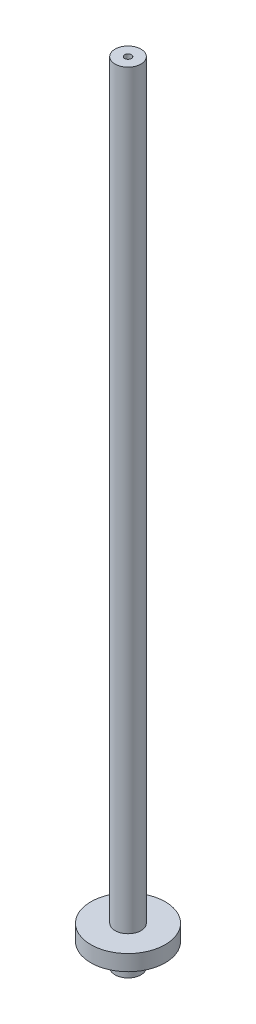
from build123d import *

# Parameters (mm, degrees)
SKETCH1_R           = 5.75
SKETCH1_R_2         = 2
BOSS_EXTRUDE1_DEPTH = 340
SKETCH33_R          = 16.5
BOSS_EXTRUDE2_DEPTH = 7
BOSS_EXTRUDE5_START = -10
SKETCH1_4_R         = 5.75
SKETCH1_4_R_2       = 2
BOSS_EXTRUDE5_DEPTH = 10
SKETCH38_R          = 2.125
CUT_EXTRUDE1_DEPTH  = 8
BOSS_EXTRUDE6_START = 8
BOSS_EXTRUDE6_DEPTH = 8
SKETCH40_R          = 1.5
CUT_EXTRUDE2_DEPTH  = 10


with BuildPart() as part:
    # Sketch1 → Boss-Extrude1 (new body)
    # profile 1 of 2: a face of its own
    with BuildSketch(Plane(origin=(0, 0, 0), x_dir=(1, 0, 0), z_dir=(0, 1, 0))):
        with Locations(Location((0, 0, 0), (0, 0, 270))):
            Circle(SKETCH1_R)
        Circle(SKETCH1_R_2, mode=Mode.SUBTRACT)
    # profile 2 of 2: a face of its own
    with BuildSketch(Plane(origin=(0, 0, 0), x_dir=(1, 0, 0), z_dir=(0, 1, 0))):
        Circle(SKETCH1_R_2)
    extrude(amount=BOSS_EXTRUDE1_DEPTH)

    # Sketch33 → Boss-Extrude2 (add)
    with BuildSketch(Plane.XZ):
        with Locations(Location((0, 0, 0), (0, 0, 270))):
            Circle(SKETCH33_R)
    extrude(amount=-BOSS_EXTRUDE2_DEPTH)

    # Sketch1<4> → Boss-Extrude5 (add)
    # profile 1 of 2: a face of its own
    with BuildSketch(Plane(origin=(0, 0, 0), x_dir=(1, 0, 0), z_dir=(0, 1, 0)).offset(BOSS_EXTRUDE5_START)):
        with Locations(Location((0, 0, 0), (0, 0, 90))):
            Circle(SKETCH1_4_R)
        Circle(SKETCH1_4_R_2, mode=Mode.SUBTRACT)
    # profile 2 of 2: a face of its own
    with BuildSketch(Plane(origin=(0, 0, 0), x_dir=(1, 0, 0), z_dir=(0, 1, 0)).offset(BOSS_EXTRUDE5_START)):
        Circle(SKETCH1_4_R_2)
    extrude(amount=BOSS_EXTRUDE5_DEPTH)

    # Sketch38 → Cut-Extrude1 (cut)
    with BuildSketch(Plane.XZ.offset(10)):
        with Locations(Location((0, 0, 0), (0, 0, 270))):
            Circle(SKETCH38_R)
    extrude(amount=-CUT_EXTRUDE1_DEPTH, mode=Mode.SUBTRACT)

    # Sketch39 → Boss-Extrude6 (add)
    with BuildSketch(Plane.XZ.offset(2).offset(BOSS_EXTRUDE6_START)):
        with BuildLine():
            ThreePointArc((1.398436627, 1.6), (0, 2.125), (-1.398436627, 1.6))
            Line((-1.398436627, 1.6), (1.398436627, 1.6))
        make_face()
    extrude(amount=-BOSS_EXTRUDE6_DEPTH)

    # Sketch40 → Cut-Extrude2 (cut)
    with BuildSketch(Plane(origin=(0, 340, 0), x_dir=(1, 0, 0), z_dir=(0, 1, 0))):
        with Locations(Location((0, 0, 0), (0, 0, 270))):
            Circle(SKETCH40_R)
    extrude(amount=-CUT_EXTRUDE2_DEPTH, mode=Mode.SUBTRACT)


solid = part.part
